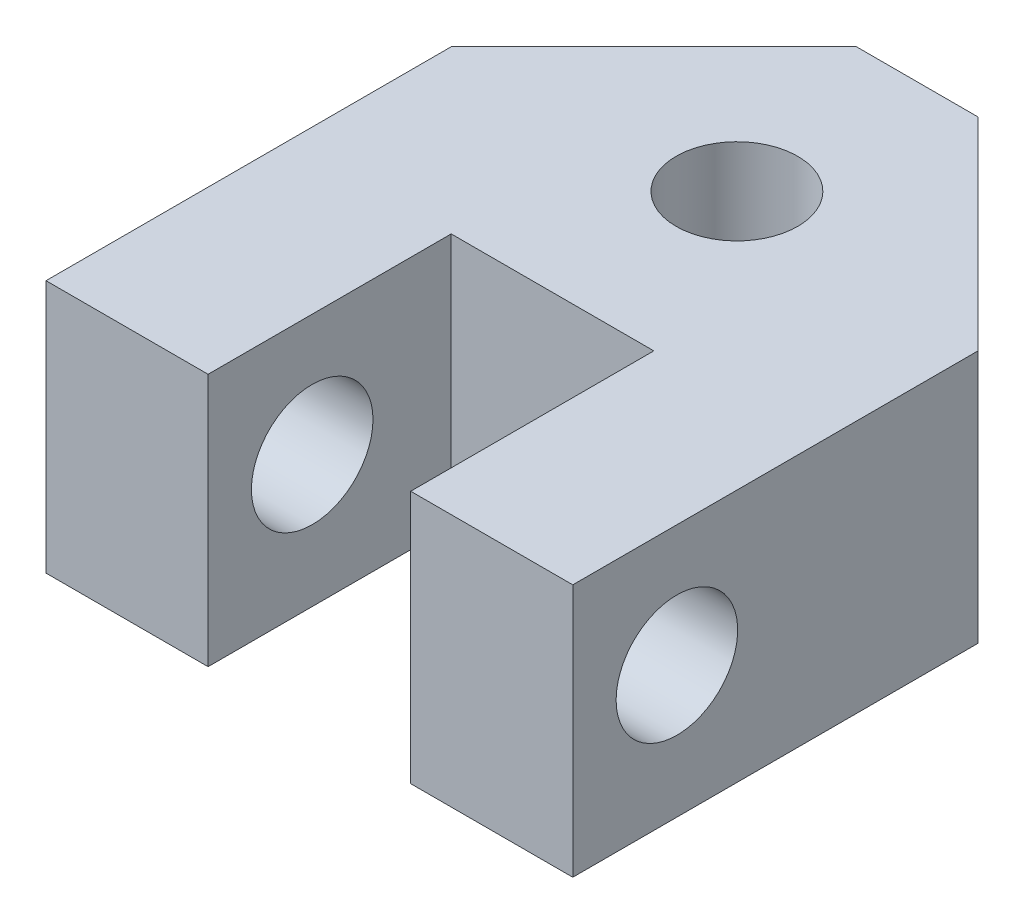
from build123d import *

# Parameters (mm, degrees)
SKETCH_1_W           = 30
SKETCH_1_H           = 13.5
EXTRUDE_1_DEPTH      = 20
SKETCH_2_W           = 10
SKETCH_2_H           = 20.163242361
CUT_EXTRUDE_2_DEPTH  = 29.41214529
SKETCH_3_R           = 3
CUT_EXTRUDE_3_DEPTH  = 37.827299657
SKETCH_6_W           = 30
SKETCH_6_H           = 13.5
EXTRUDE_5_DEPTH      = 10
SKETCH_7_R           = 3
CUT_EXTRUDE_1_DEPTH  = 29.41214529
SKETCH_9_W           = 6.52399098
SKETCH_9_H           = 33.458140235
CUT_EXTRUDE_6_DEPTH  = 29.41214529
SKETCH_14_W          = 84.903926308
SKETCH_14_H          = 44.963333207
CUT_EXTRUDE_10_DEPTH = 1
CHAMFER1_SIZE        = 10


with BuildPart() as part:
    # Эскиз1 → Вытянуть1 (new body)
    with BuildSketch(Plane.XY):
        with Locations((0, -0.75)):
            Rectangle(SKETCH_1_W, SKETCH_1_H)
    extrude(amount=EXTRUDE_1_DEPTH)

    # Эскиз2 → Вытянуть2 (cut, through all)
    with BuildSketch(Plane.XZ.offset(7.5)):
        with Locations((0, 18.081621181)):
            Rectangle(SKETCH_2_W, SKETCH_2_H)
    extrude(amount=-CUT_EXTRUDE_2_DEPTH, mode=Mode.SUBTRACT)

    # Эскиз3 → Вытянуть3 (cut, through all)
    with BuildSketch(Plane(origin=(15, 0, 0), x_dir=(0, 0, -1), z_dir=(1, 0, 0))):
        with Locations(Location((-14.861357689, 0, 0), (0, 0, 90))):
            Circle(SKETCH_3_R)
    extrude(amount=-CUT_EXTRUDE_3_DEPTH, mode=Mode.SUBTRACT)

    # Эскиз6 → Вытянуть5 (add)
    with BuildSketch(Plane(origin=(0, 0, 0), x_dir=(-1, 0, 0), z_dir=(0, 0, -1))):
        with Locations((0, -0.75)):
            Rectangle(SKETCH_6_W, SKETCH_6_H)
    extrude(amount=EXTRUDE_5_DEPTH)

    # Эскиз7 → Вырез-Вытянуть1 (cut, through all)
    with BuildSketch(Plane(origin=(0, 6, 0), x_dir=(1, 0, 0), z_dir=(0, 1, 0))):
        with Locations(Location((0.231400022, 0.869933179, 0), (0, 0, 270))):
            Circle(SKETCH_7_R)
    extrude(amount=-CUT_EXTRUDE_1_DEPTH, mode=Mode.SUBTRACT)

    # Эскиз9 → Вытянуть6 (cut, through all)
    with BuildSketch(Plane(origin=(0, 6, 0), x_dir=(1, 0, 0), z_dir=(0, 1, 0))):
        with Locations((16.26199549, -3.329208479)):
            Rectangle(SKETCH_9_W, SKETCH_9_H)
        with Locations((-16.26199549, -3.329208479)):
            Rectangle(SKETCH_9_W, SKETCH_9_H)
    extrude(amount=-CUT_EXTRUDE_6_DEPTH, mode=Mode.SUBTRACT)

    # Эскиз14 → Вытянуть10 (cut)
    with BuildSketch(Plane.XZ.offset(7.5)):
        with Locations((0.061866905, -0.327668242)):
            Rectangle(SKETCH_14_W, SKETCH_14_H)
    extrude(amount=-CUT_EXTRUDE_10_DEPTH, mode=Mode.SUBTRACT)

    # Chamfer1
    chamfer1_edges = [part.edges().sort_by_distance(p)[0] for p in [
        (-13, -0.25, -10),
        (13, -0.25, -10),
    ]]
    chamfer(chamfer1_edges, length=CHAMFER1_SIZE)


solid = part.part
